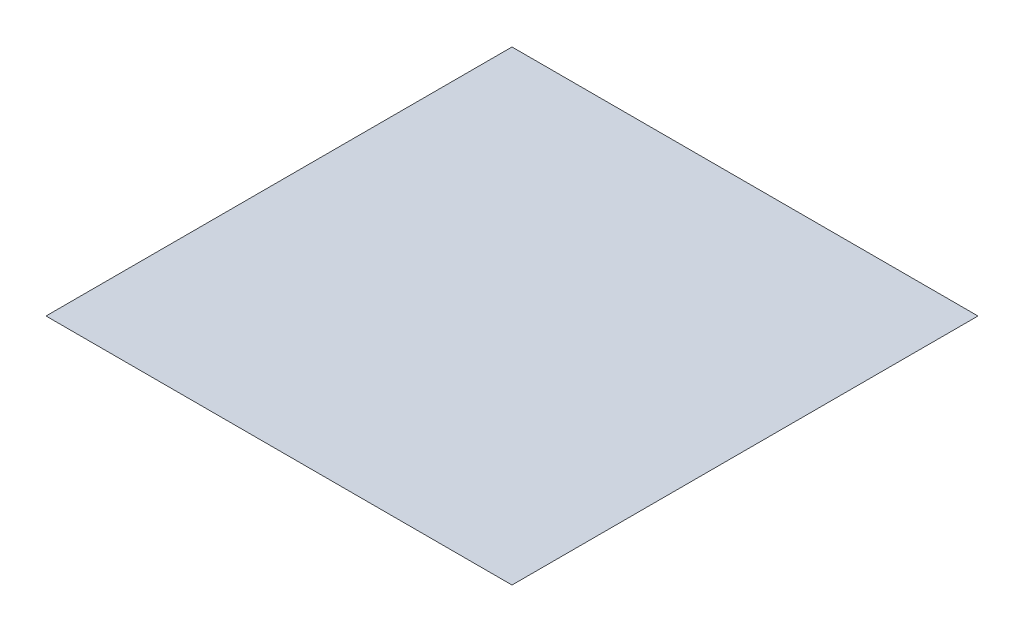
from build123d import *

# Parameters (mm, degrees)
SKETCH5_W          = 150
SKETCH5_H          = 150
CUT_EXTRUDE1_DEPTH = 100


with BuildPart() as part:
    # Sketch1 → Loft1 section 0
    with BuildSketch(Plane(origin=(0, 0, 0), x_dir=(1, 0, 0), z_dir=(0, 1, 0)), mode=Mode.PRIVATE) as loft1_s0:
        with BuildLine():
            Line((-500, -500), (500, -500))
            Line((500, -500), (500, 500))
            Line((500, 500), (-500, 500))
            Line((-500, 500), (-500, -500))
        make_face()
    loft([loft1_s0.sketch, Vertex(0, -400, 0)])

    # Sketch5 → Cut-Extrude1 (cut)
    with BuildSketch(Plane(origin=(0, -400, 0), x_dir=(-1, 0, 0), z_dir=(0, -1, 0))):
        Rectangle(SKETCH5_W, SKETCH5_H)
    extrude(amount=-CUT_EXTRUDE1_DEPTH, mode=Mode.SUBTRACT)


solid = part.part
